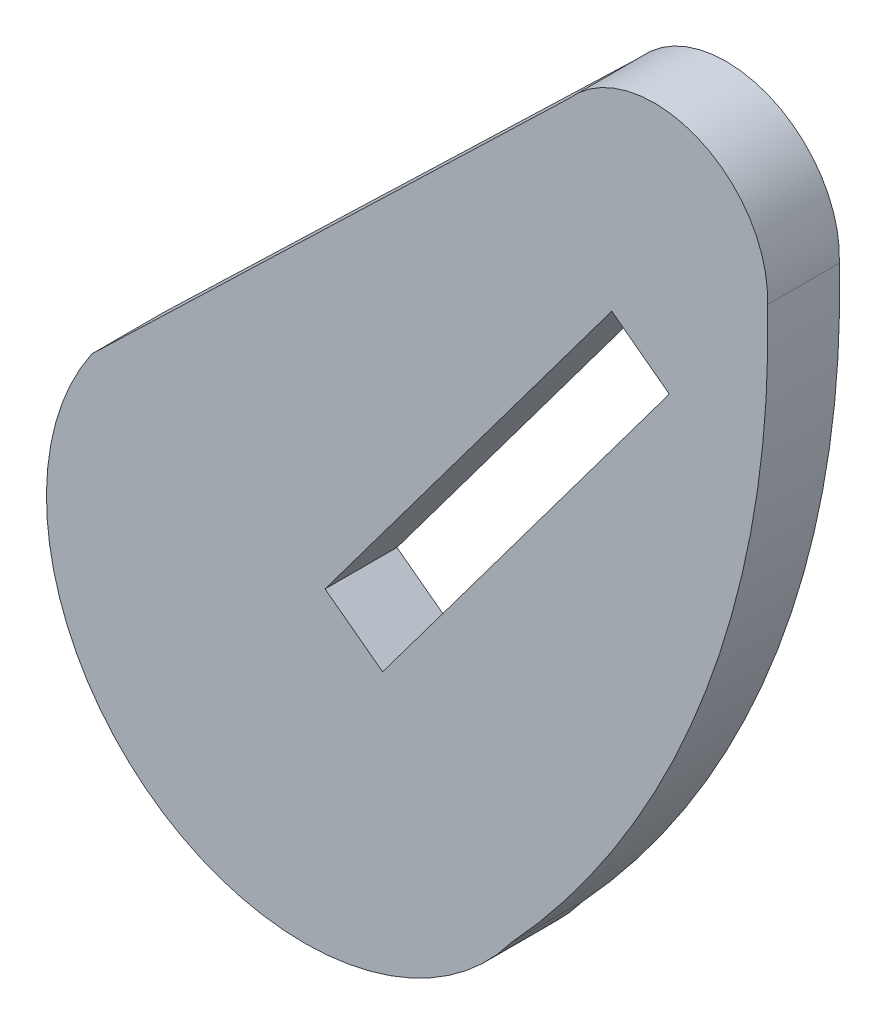
from build123d import *

# Parameters (mm, degrees)
BASE_EXTRUDE_DEPTH = 3


with BuildPart() as part:
    # Sketch1 → Base-Extrude (new body)
    with BuildSketch(Plane.XY):
        with BuildLine():
            Line((-809.531671811, -111.229676779), (-789.61413801, -92.039559057))
            ThreePointArc((-789.61413801, -92.039559057), (-784.29578657, -90.751569276), (-781.326120484, -95.347748455))
            ThreePointArc((-781.326120484, -95.347748455), (-783.901412566, -110.604895358), (-792.031629072, -123.769706047))
            ThreePointArc((-792.031629072, -123.769706047), (-806.92926697, -126.078902011), (-809.531671811, -111.229676779))
        make_face()
        Polygon((-797.390770347, -116.654380858), (-785.42322433, -100.630091722), (-787.826867701, -98.834959819), (-799.794413717, -114.859248956), align=None, mode=Mode.SUBTRACT)
    extrude(amount=BASE_EXTRUDE_DEPTH)


solid = part.part
